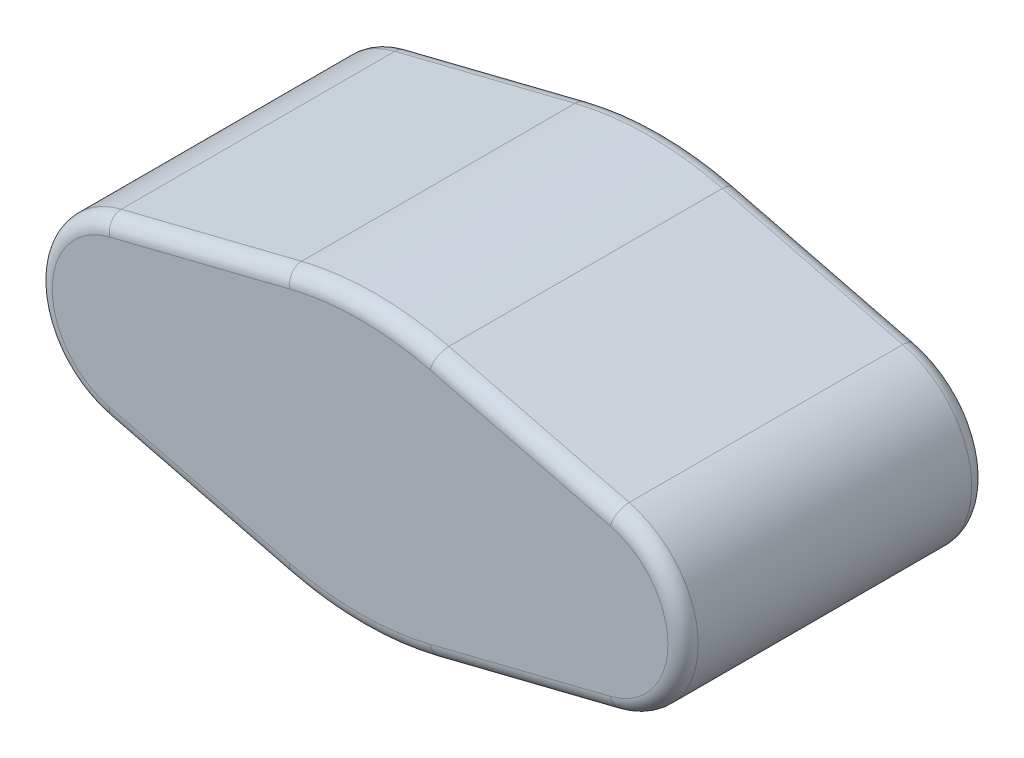
from build123d import *

# Parameters (mm, degrees)
EXTRUDE_1_DEPTH = 10
FILLET_1_R      = 10
FILLET_2_R      = 3
SKETCH_2_R      = 3
EXTRUDE_2_DEPTH = 1
FILLET_3_R      = 0.5


with BuildPart() as part:
    # Эскиз1 → Бобышка-Вытянуть1 (new body)
    with BuildSketch(Plane.XY):
        Polygon((0, 0), (-20, -5), (0, -10), (20, -5), align=None)
    extrude(amount=EXTRUDE_1_DEPTH)

    # Скругление1
    fillet_1_edges = [part.edges().sort_by_distance(p)[0] for p in [
        (0, -10, 5),
        (0, 0, 5),
    ]]
    fillet(fillet_1_edges, radius=FILLET_1_R)

    # Скругление2
    fillet_2_edges = [part.edges().sort_by_distance(p)[0] for p in [
        (20, -5, 5),
        (-20, -5, 5),
    ]]
    fillet(fillet_2_edges, radius=FILLET_2_R)

    # Эскиз2 → Бобышка-Вытянуть2 (add)
    with BuildSketch(Plane(origin=(0, 0, 0), x_dir=(-1, 0, 0), z_dir=(0, 0, -1))):
        with Locations(Location((0, -5, 0), (0, 0, 180))):
            Circle(SKETCH_2_R)
    extrude(amount=EXTRUDE_2_DEPTH)

    # Скругление3
    fillet_3_edges = [part.edges().sort_by_distance(p)[0] for p in [
        (5.391823124, -8.652044219, 0),
        (5.391823124, -8.652044219, 10),
        (-5.391823124, -1.347955781, 0),
        (0, -0.307764064, 0),
        (0, -9.692235936, 0),
        (-5.391823124, -1.347955781, 10),
        (0, -0.307764064, 10),
        (0, -9.692235936, 10),
        (5.391823124, -1.347955781, 0),
        (5.391823124, -1.347955781, 10),
        (-5.391823124, -8.652044219, 0),
        (-10.630683123, -5, 0),
        (10.630683123, -5, 0),
        (-5.391823124, -8.652044219, 10),
        (-10.630683123, -5, 10),
        (10.630683123, -5, 10),
    ]]
    fillet(fillet_3_edges, radius=FILLET_3_R)


solid = part.part
